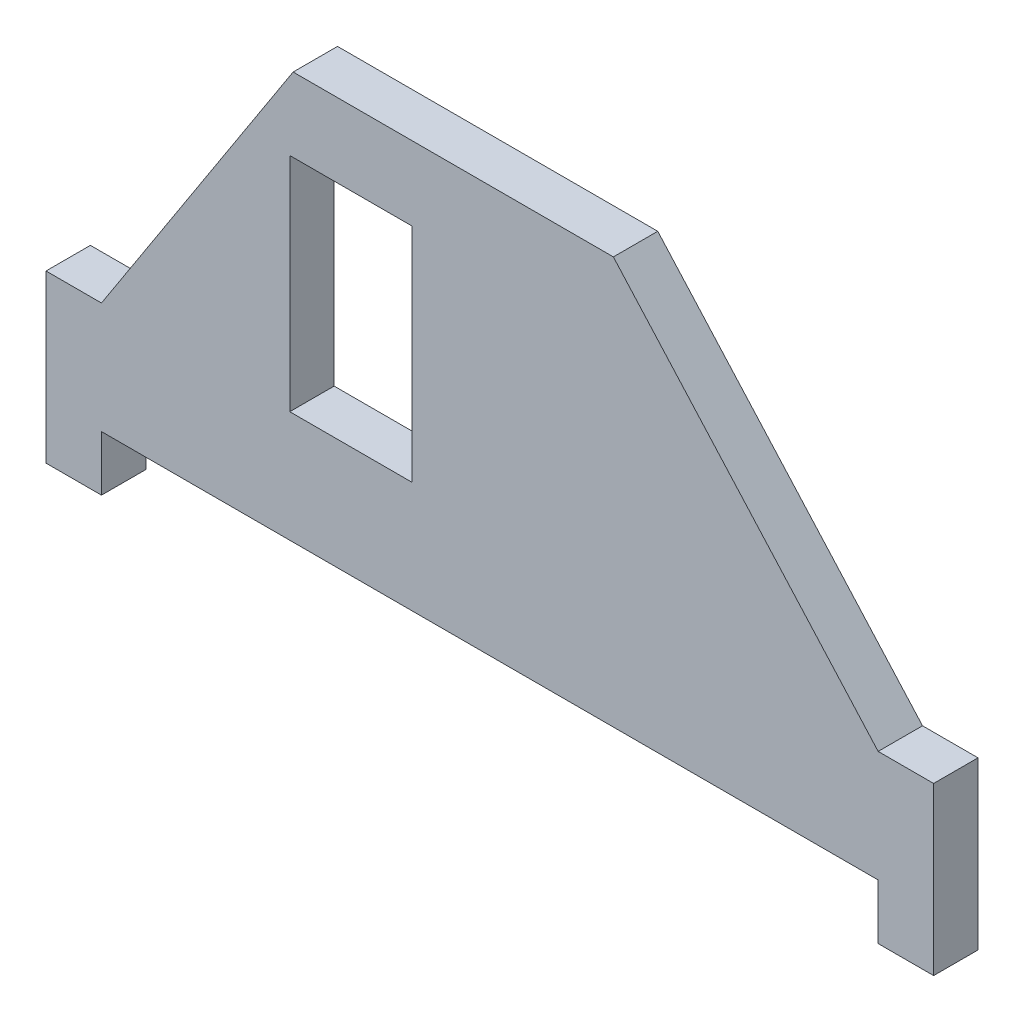
from build123d import *

# Parameters (mm, degrees)
SKETCH2_W           = 279.4
SKETCH2_H           = 508
BOSS_EXTRUDE2_DEPTH = 101.6


with BuildPart() as part:
    # Sketch2 → Boss-Extrude2 (new body)
    with BuildSketch(Plane.XY):
        Polygon((1905, 0), (1905, 126.133511643), (127, 126.133511643), (127, 0), (0, 0), (0, 381), (127, 381), (565.751483096, 1058.333333333), (1298.870787435, 1058.333333333), (1905, 381), (2032, 381), (2032, 0), align=None)
        with Locations((697.738, 635)):
            Rectangle(SKETCH2_W, SKETCH2_H, mode=Mode.SUBTRACT)
    extrude(amount=BOSS_EXTRUDE2_DEPTH)


solid = part.part
